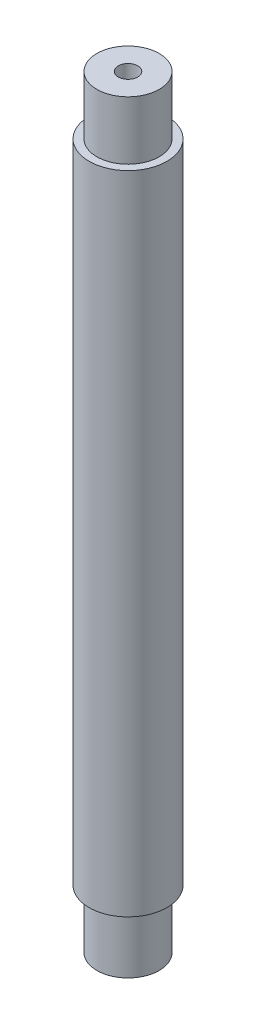
from build123d import *


with BuildPart() as part:
    # Szkic1 → Obrót1 (revolve)
    with BuildSketch(Plane.XY, mode=Mode.PRIVATE) as obr_t1_sk:
        Polygon((0, 18), (0, 0), (8, 0), (8, 15), (10, 15), (10, 181), (8, 181), (8, 196), (2.5, 196), (2.5, 178), (8, 178), (8, 18), align=None)
    revolve(obr_t1_sk.sketch.rotate(Axis((0, 0, 0), (0, 1, 0)), 90), axis=Axis((0, 0, 0), (0, 1, 0)))


solid = part.part
